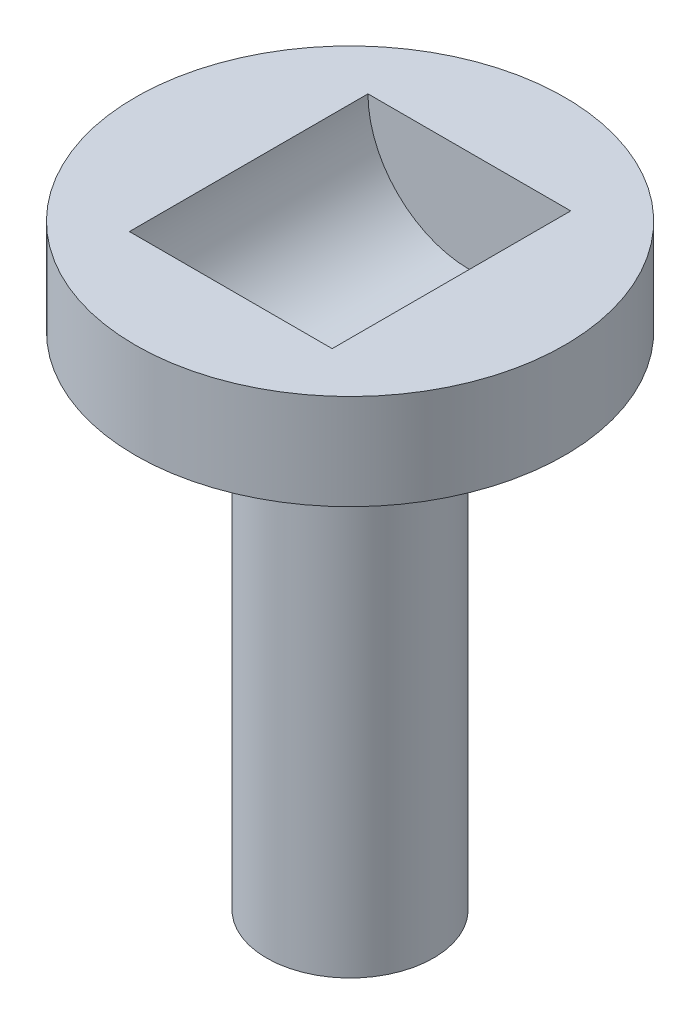
from build123d import *

# Parameters (mm, degrees)
CROQUIS2_R                 = 3.5
SALIENTE_EXTRUIR1_DEPTH    = 20
CROQUIS3_R                 = 7.5
SALIENTE_EXTRUIR2_DEPTH    = 1
CROQUIS5_R                 = 9
SALIENTE_EXTRUIR3_DEPTH    = 4
CORTAR_EXTRUIR1_DEPTH      = 5
CORTAR_EXTRUIR1_DEPTH_BACK = 5
CROQUIS6_R                 = 4.25
CROQUIS7_R                 = 0.75
CORTAR_EXTRUIR2_DEPTH      = 5


with BuildPart() as part:
    # Croquis2 → Saliente-Extruir1 (new body)
    with BuildSketch(Plane(origin=(0, 0, 0), x_dir=(1, 0, 0), z_dir=(0, 1, 0))):
        Circle(CROQUIS2_R)
    extrude(amount=SALIENTE_EXTRUIR1_DEPTH)

    # Croquis3 → Saliente-Extruir2 (add)
    with BuildSketch(Plane(origin=(0, 20, 0), x_dir=(1, 0, 0), z_dir=(0, 1, 0))):
        Circle(CROQUIS3_R)
    extrude(amount=SALIENTE_EXTRUIR2_DEPTH)

    # Croquis5 → Saliente-Extruir3 (add)
    with BuildSketch(Plane(origin=(0, 21, 0), x_dir=(1, 0, 0), z_dir=(0, 1, 0))):
        Circle(CROQUIS5_R)
    extrude(amount=SALIENTE_EXTRUIR3_DEPTH)

    # Croquis6 → Cortar-Extruir1 (cut, two sides: drawn at the far end of the back side and taken through both)
    with BuildSketch(Plane.XY.offset(-CORTAR_EXTRUIR1_DEPTH_BACK)):
        with Locations((0, 25)):
            Circle(CROQUIS6_R)
    extrude(amount=CORTAR_EXTRUIR1_DEPTH + CORTAR_EXTRUIR1_DEPTH_BACK, mode=Mode.SUBTRACT)

    # Croquis7 → Cortar-Extruir2 (cut)
    with BuildSketch(Plane.XZ):
        Circle(CROQUIS7_R)
    extrude(amount=-CORTAR_EXTRUIR2_DEPTH, mode=Mode.SUBTRACT)


solid = part.part
